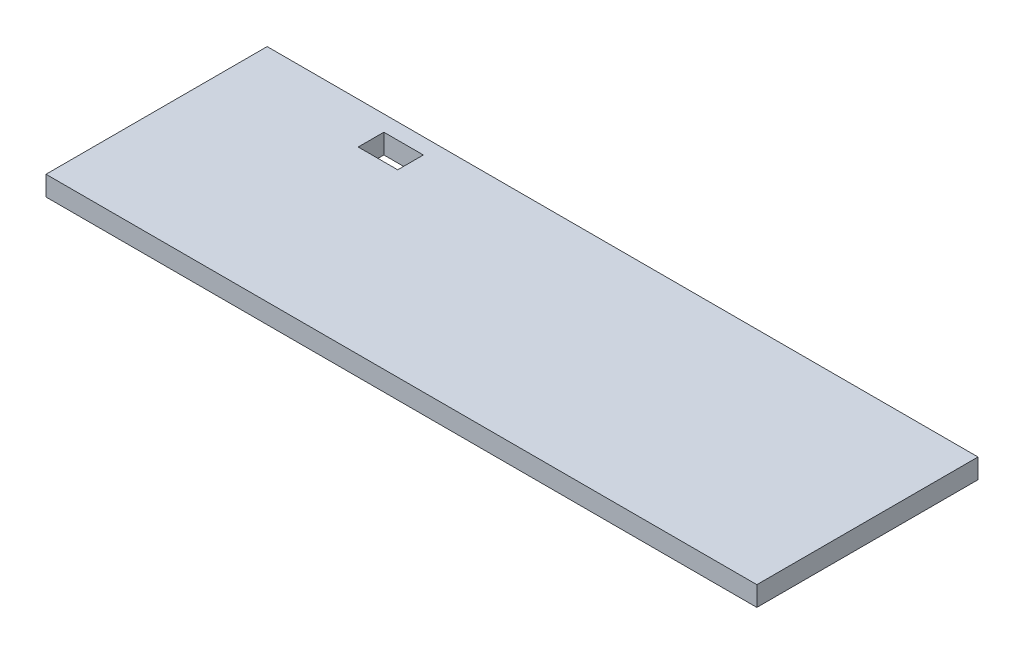
from build123d import *

# Parameters (mm, degrees)
IZIM1_W                     = 180
IZIM1_H                     = 56
IZIM1_W_2                   = 10
IZIM1_H_2                   = 6.5
Y_KSEKLIK_EKSTR_ZYON1_DEPTH = 5


with BuildPart() as part:
    # Çizim1 → Yükseklik-Ekstrüzyon1 (new body)
    with BuildSketch(Plane(origin=(0, 0, 0), x_dir=(1, 0, 0), z_dir=(0, 1, 0))):
        Rectangle(IZIM1_W, IZIM1_H)
        with Locations((-51.44343362, 20.75)):
            Rectangle(IZIM1_W_2, IZIM1_H_2, mode=Mode.SUBTRACT)
    extrude(amount=Y_KSEKLIK_EKSTR_ZYON1_DEPTH)


solid = part.part
